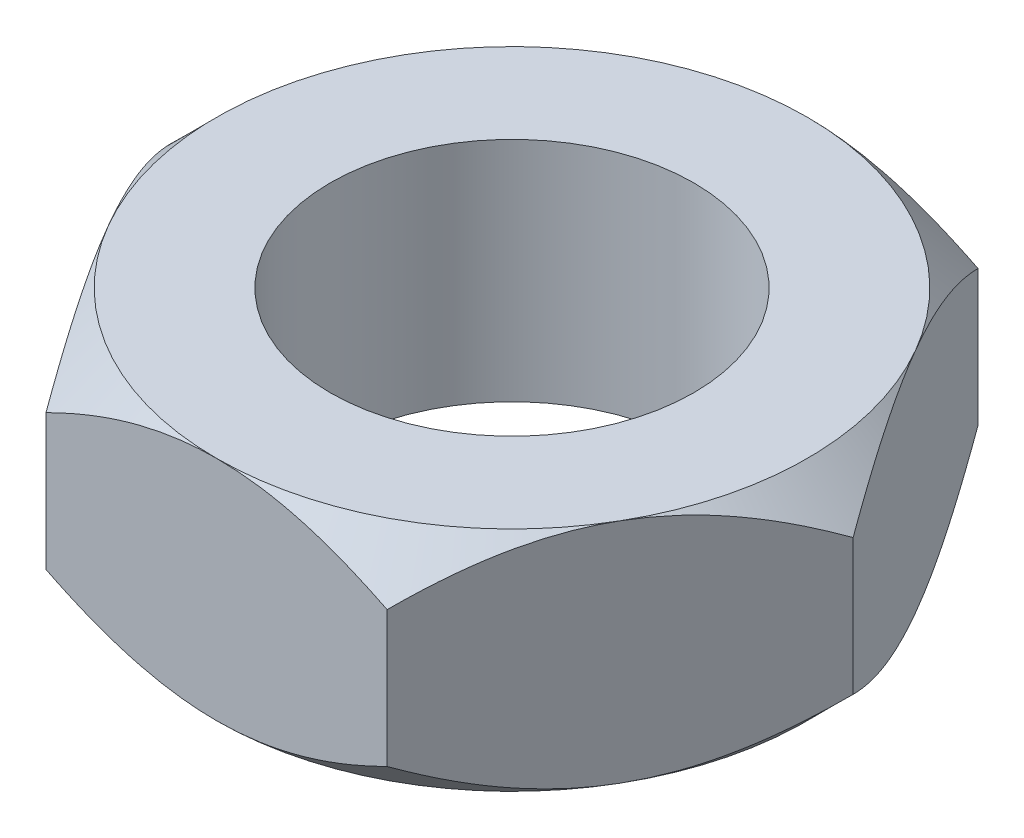
from build123d import *

# Parameters (mm, degrees)
BOSS_EXTRUDE1_DEPTH     = 5
SKETCH2_OUTSIDE_W       = 45.342
SKETCH2_OUTSIDE_H       = 43.33
SKETCH2_OUTSIDE_R       = 6.5
CUT_EXTRUDE1_DEPTH      = 12.116804097
CUT_EXTRUDE1_DRAFT      = -45
MIRROR1_COPY_1_SKETCH_W = 45.342
MIRROR1_COPY_1_SKETCH_H = 43.33
MIRROR1_COPY_1_SKETCH_R = 6.5
MIRROR1_COPY_1_DEPTH    = 12.116804097
MIRROR1_COPY_1_DRAFT    = -45
SKETCH3_R               = 4
CUT_EXTRUDE2_DEPTH      = 12.116804097


with BuildPart() as part:
    # Sketch1 → Boss-Extrude1 (new body)
    with BuildSketch(Plane(origin=(0, 0, 0), x_dir=(1, 0, 0), z_dir=(0, 1, 0))):
        Polygon((7.505553499, 0), (3.75277675, 6.5), (-3.75277675, 6.5), (-7.505553499, 0), (-3.75277675, -6.5), (3.75277675, -6.5), align=None)
    extrude(amount=BOSS_EXTRUDE1_DEPTH)


with BuildPart() as cut_extrude1_tool:
    # Sketch2 outside → Cut-Extrude1 (with draft: the straight prism first)
    with BuildSketch(Plane(origin=(0, 5, 0), x_dir=(1, 0, 0), z_dir=(0, 1, 0))):
        Rectangle(SKETCH2_OUTSIDE_W, SKETCH2_OUTSIDE_H)
        Circle(SKETCH2_OUTSIDE_R, mode=Mode.SUBTRACT)
    extrude(amount=-CUT_EXTRUDE1_DEPTH)
    # Cut-Extrude1: the draft: its side faces are tilted about the plane it starts from
    cut_extrude1_sides = [cut_extrude1_tool.faces().sort_by_distance(p)[0] for p in [
        (0, -1.058402049, 21.665),
        (22.671, -1.058402049, 0),
        (0, -1.058402049, -21.665),
        (-22.671, -1.058402049, 0),
        (-6.5, -1.058402049, 0),
    ]]
    draft(cut_extrude1_sides, Plane(origin=(0, 5, 0), x_dir=(1, 0, 0), z_dir=(0, 1, 0)), CUT_EXTRUDE1_DRAFT)


with BuildPart() as part_1:
    add(part.part)

    # Cut-Extrude1: cut by cut_extrude1_tool
    add(cut_extrude1_tool.part, mode=Mode.SUBTRACT)


with BuildPart() as mirror1_copy_1_tool:
    # Mirror1 copy 1 sketch → Mirror1 copy 1 (with draft: the straight prism first)
    with BuildSketch(Plane.XZ):
        Rectangle(MIRROR1_COPY_1_SKETCH_W, MIRROR1_COPY_1_SKETCH_H)
        Circle(MIRROR1_COPY_1_SKETCH_R, mode=Mode.SUBTRACT)
    extrude(amount=-MIRROR1_COPY_1_DEPTH)
    # Mirror1 copy 1: the draft: its side faces are tilted about the plane it starts from
    mirror1_copy_1_sides = [mirror1_copy_1_tool.faces().sort_by_distance(p)[0] for p in [
        (0, 6.058402049, 21.665),
        (22.671, 6.058402049, 0),
        (0, 6.058402049, -21.665),
        (-22.671, 6.058402049, 0),
        (-6.5, 6.058402049, 0),
    ]]
    draft(mirror1_copy_1_sides, Plane.XZ, MIRROR1_COPY_1_DRAFT)


with BuildPart() as part_2:
    add(part_1.part)

    # Mirror1 copy 1: cut by mirror1_copy_1_tool
    add(mirror1_copy_1_tool.part, mode=Mode.SUBTRACT)

    # Sketch3 → Cut-Extrude2 (cut, through all)
    with BuildSketch(Plane(origin=(0, 5, 0), x_dir=(1, 0, 0), z_dir=(0, 1, 0))):
        with Locations(Location((0, 0, 0), (0, 0, 270))):
            Circle(SKETCH3_R)
    extrude(amount=-CUT_EXTRUDE2_DEPTH, mode=Mode.SUBTRACT)


solid = part_2.part
